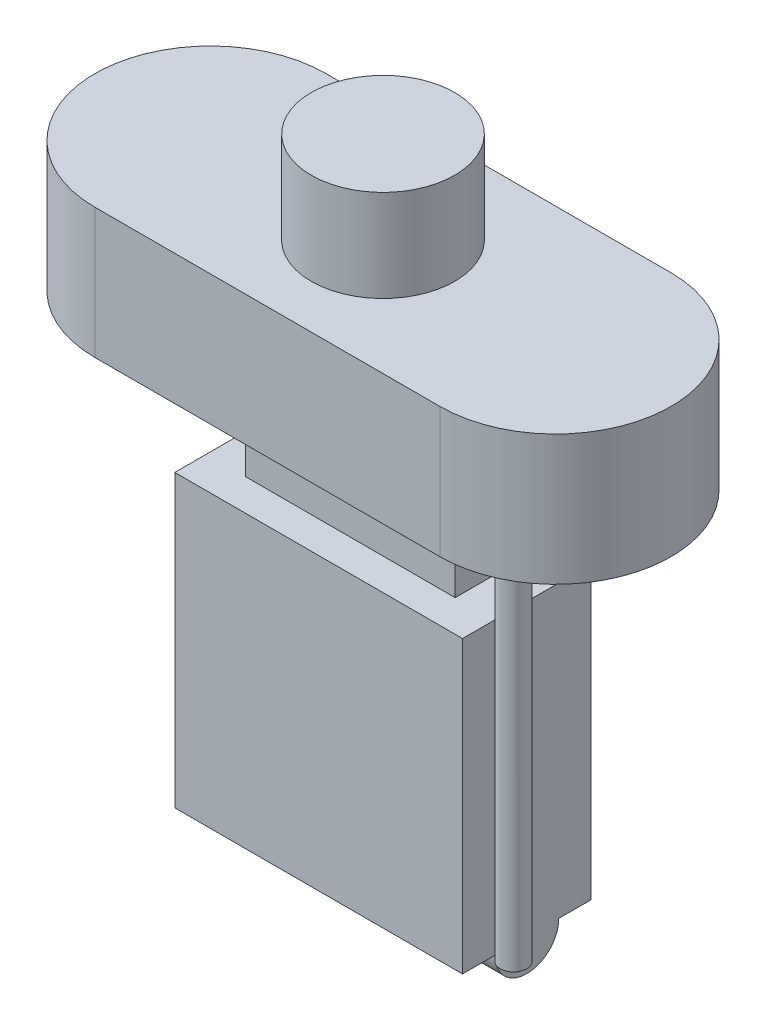
from build123d import *

# Parameters (mm, degrees)
BOSS_EXTRU_1_DEPTH      = 8.9916
ESQUISSE2_R             = 9.906
BOSS_EXTRU_2_DEPTH      = 12.7
BOSS_EXTRU_3_DEPTH      = 6.096
CONG_1_R                = 2.54
ESQUISSE4_W             = 28.956
ESQUISSE4_H             = 9.017
BOSS_EXTRU_4_DEPTH      = 9.2202
ESQUISSE5_W             = 39.751
ESQUISSE5_H             = 17.78
BOSS_EXTRU_5_DEPTH      = 40.132
ESQUISSE6_R             = 4.4069
BOSS_EXTRU_6_DEPTH      = 39.751
ESQUISSE7_R             = 2.921
ENL_V_MAT_EXTRU_1_DEPTH = 2.54
ESQUISSE8_R             = 1.825
BOSS_EXTRU_7_DEPTH      = 50.8


with BuildPart() as part:
    # Esquisse1 → Boss.-Extru.1 (new, symmetric)
    with BuildSketch(Plane(origin=(0, 0, 0), x_dir=(1, 0, 0), z_dir=(0, 1, 0))):
        with BuildLine():
            Line((-23.8379, 15.9766), (23.8379, 15.9766))
            ThreePointArc((23.8379, 15.9766), (39.8145, 0), (23.8379, -15.9766))
            Line((23.8379, -15.9766), (-23.8379, -15.9766))
            ThreePointArc((-23.8379, -15.9766), (-39.8145, 0), (-23.8379, 15.9766))
        make_face()
    extrude(amount=BOSS_EXTRU_1_DEPTH, both=True)

    # Esquisse2 → Boss.-Extru.2 (add)
    with BuildSketch(Plane(origin=(0, 8.9916, 0), x_dir=(1, 0, 0), z_dir=(0, 1, 0))):
        with Locations(Location((0, 0, 0), (0, 0, 270))):
            Circle(ESQUISSE2_R)
    extrude(amount=BOSS_EXTRU_2_DEPTH)

    # Esquisse3 → Boss.-Extru.3 (add)
    with BuildSketch(Plane.XZ.offset(8.9916)):
        with BuildLine():
            Line((-10.795, 9.525), (10.795, 9.525))
            ThreePointArc((10.795, 9.525), (20.32, 0), (10.795, -9.525))
            Line((10.795, -9.525), (-10.795, -9.525))
            ThreePointArc((-10.795, -9.525), (-20.32, 0), (-10.795, 9.525))
        make_face()
    extrude(amount=BOSS_EXTRU_3_DEPTH)

    # Congé1
    cong_1_edges = [part.edges().sort_by_distance(p)[0] for p in [
        (-20.32, -8.9916, 0),
        (0, -8.9916, -9.525),
        (20.32, -8.9916, 0),
        (0, -8.9916, 9.525),
    ]]
    fillet(cong_1_edges, radius=CONG_1_R)

    # Esquisse4 → Boss.-Extru.4 (add)
    with BuildSketch(Plane.XZ.offset(15.0876)):
        Rectangle(ESQUISSE4_W, ESQUISSE4_H)
    extrude(amount=BOSS_EXTRU_4_DEPTH)

    # Esquisse5 → Boss.-Extru.5 (add)
    with BuildSketch(Plane.XZ.offset(24.3078)):
        Rectangle(ESQUISSE5_W, ESQUISSE5_H)
    extrude(amount=BOSS_EXTRU_5_DEPTH)

    # Esquisse6 → Boss.-Extru.6 (add)
    with BuildSketch(Plane(origin=(19.8755, 0, 0), x_dir=(0, 0, -1), z_dir=(1, 0, 0))):
        with Locations((0, -64.4398)):
            Circle(ESQUISSE6_R)
    extrude(amount=-BOSS_EXTRU_6_DEPTH)

    # Esquisse7 → Enlèv. mat.-Extru.1 (cut)
    with BuildSketch(Plane(origin=(0, 0, -8.89), x_dir=(-1, 0, 0), z_dir=(0, 0, -1))):
        with Locations((0, -45.487412675)):
            Circle(ESQUISSE7_R)
    extrude(amount=-ENL_V_MAT_EXTRU_1_DEPTH, mode=Mode.SUBTRACT)

    # Esquisse8 → Boss.-Extru.7 (add)
    with BuildSketch(Plane.XZ.offset(8.9916)):
        with Locations(Location((26.513063704, 8.491811342, 0), (0, 0, 90))):
            Circle(ESQUISSE8_R)
    extrude(amount=BOSS_EXTRU_7_DEPTH)


solid = part.part
